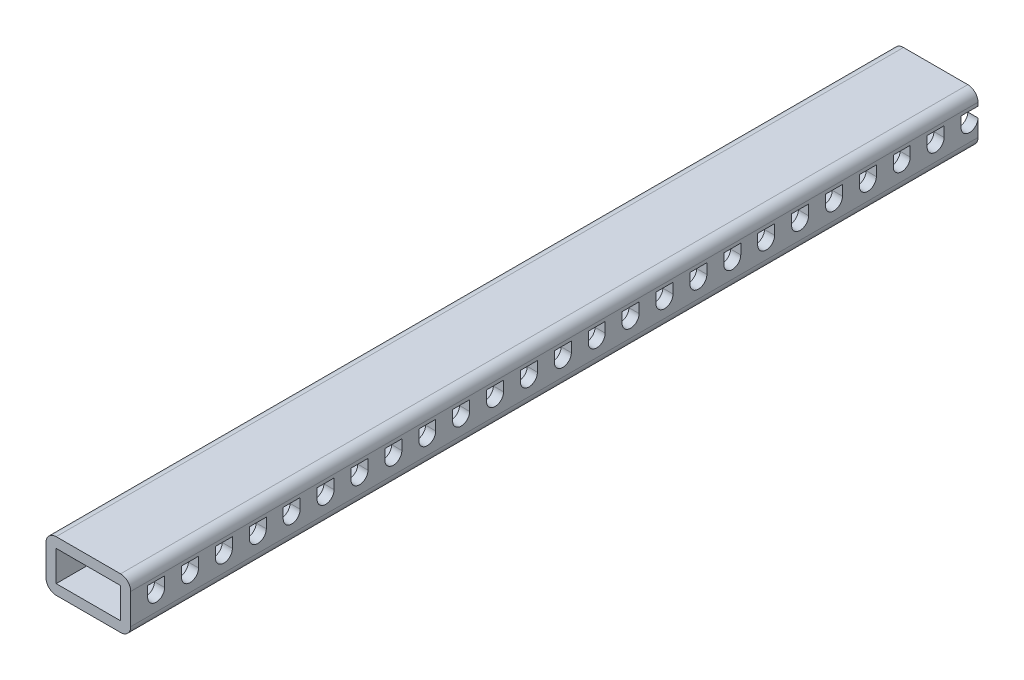
from build123d import *

# Parameters (mm, degrees)
SKETCH1_W           = 25
SKETCH1_H           = 15
BOSS_EXTRUDE1_DEPTH = 520
SKETCH2_W           = 19
SKETCH2_H           = 9
CUT_EXTRUDE1_DEPTH  = 263
CUT_EXTRUDE2_DEPTH  = 263
FILLET1_R           = 3
CUT_EXTRUDE6_DEPTH  = 29
SKETCH8_W           = 19
SKETCH8_H           = 9
CUT_EXTRUDE7_DEPTH  = 535
SKETCH9_W           = 298.646139341
SKETCH9_H           = 109.168966902
CUT_EXTRUDE8_DEPTH  = 64
SKETCH10_W          = 91.44174092
SKETCH10_H          = 50
CUT_EXTRUDE9_DEPTH  = 70


with BuildPart() as part:
    # Sketch1 → Boss-Extrude1 (new body)
    with BuildSketch(Plane.XY):
        Rectangle(SKETCH1_W, SKETCH1_H)
    extrude(amount=BOSS_EXTRUDE1_DEPTH)

    # Sketch2 → Cut-Extrude1 (cut)
    with BuildSketch(Plane.XY.offset(520)):
        Rectangle(SKETCH2_W, SKETCH2_H)
    extrude(amount=-CUT_EXTRUDE1_DEPTH, mode=Mode.SUBTRACT)

    # Sketch3 → Cut-Extrude2 (cut)
    with BuildSketch(Plane(origin=(12.5, 0, 0), x_dir=(0, 0, -1), z_dir=(1, 0, 0))):
        with BuildLine():
            Line((-515, 3.5), (-515, 0.5))
            ThreePointArc((-515, 0.5), (-512.5, -2), (-510, 0.5))
            Line((-510, 0.5), (-510, 3.5))
            Line((-510, 3.5), (-515, 3.5))
        make_face()
        with BuildLine():
            ThreePointArc((-500, 0.5), (-502.5, -2), (-505, 0.5))
            Line((-505, 0.5), (-505, 3.5))
            Line((-505, 3.5), (-500, 3.5))
            Line((-500, 3.5), (-500, 0.5))
        make_face()
        with BuildLine():
            Line((-495, 3.5), (-495, 0.5))
            ThreePointArc((-495, 0.5), (-492.5, -2), (-490, 0.5))
            Line((-490, 0.5), (-490, 3.5))
            Line((-490, 3.5), (-495, 3.5))
        make_face()
        with BuildLine():
            ThreePointArc((-480, 0.5), (-482.5, -2), (-485, 0.5))
            Line((-485, 0.5), (-485, 3.5))
            Line((-485, 3.5), (-480, 3.5))
            Line((-480, 3.5), (-480, 0.5))
        make_face()
        with BuildLine():
            Line((-475, 3.5), (-475, 0.5))
            ThreePointArc((-475, 0.5), (-472.5, -2), (-470, 0.5))
            Line((-470, 0.5), (-470, 3.5))
            Line((-470, 3.5), (-475, 3.5))
        make_face()
        with BuildLine():
            ThreePointArc((-460, 0.5), (-462.5, -2), (-465, 0.5))
            Line((-465, 0.5), (-465, 3.5))
            Line((-465, 3.5), (-460, 3.5))
            Line((-460, 3.5), (-460, 0.5))
        make_face()
        with BuildLine():
            Line((-455, 3.5), (-455, 0.5))
            ThreePointArc((-455, 0.5), (-452.5, -2), (-450, 0.5))
            Line((-450, 0.5), (-450, 3.5))
            Line((-450, 3.5), (-455, 3.5))
        make_face()
        with BuildLine():
            ThreePointArc((-440, 0.5), (-442.5, -2), (-445, 0.5))
            Line((-445, 0.5), (-445, 3.5))
            Line((-445, 3.5), (-440, 3.5))
            Line((-440, 3.5), (-440, 0.5))
        make_face()
        with BuildLine():
            Line((-435, 3.5), (-435, 0.5))
            ThreePointArc((-435, 0.5), (-432.5, -2), (-430, 0.5))
            Line((-430, 0.5), (-430, 3.5))
            Line((-430, 3.5), (-435, 3.5))
        make_face()
        with BuildLine():
            ThreePointArc((-420, 0.5), (-422.5, -2), (-425, 0.5))
            Line((-425, 0.5), (-425, 3.5))
            Line((-425, 3.5), (-420, 3.5))
            Line((-420, 3.5), (-420, 0.5))
        make_face()
        with BuildLine():
            Line((-415, 3.5), (-415, 0.5))
            ThreePointArc((-415, 0.5), (-412.5, -2), (-410, 0.5))
            Line((-410, 0.5), (-410, 3.5))
            Line((-410, 3.5), (-415, 3.5))
        make_face()
        with BuildLine():
            ThreePointArc((-400, 0.5), (-402.5, -2), (-405, 0.5))
            Line((-405, 0.5), (-405, 3.5))
            Line((-405, 3.5), (-400, 3.5))
            Line((-400, 3.5), (-400, 0.5))
        make_face()
        with BuildLine():
            Line((-395, 3.5), (-395, 0.5))
            ThreePointArc((-395, 0.5), (-392.5, -2), (-390, 0.5))
            Line((-390, 0.5), (-390, 3.5))
            Line((-390, 3.5), (-395, 3.5))
        make_face()
        with BuildLine():
            ThreePointArc((-380, 0.5), (-382.5, -2), (-385, 0.5))
            Line((-385, 0.5), (-385, 3.5))
            Line((-385, 3.5), (-380, 3.5))
            Line((-380, 3.5), (-380, 0.5))
        make_face()
        with BuildLine():
            Line((-375, 3.5), (-375, 0.5))
            ThreePointArc((-375, 0.5), (-372.5, -2), (-370, 0.5))
            Line((-370, 0.5), (-370, 3.5))
            Line((-370, 3.5), (-375, 3.5))
        make_face()
        with BuildLine():
            ThreePointArc((-360, 0.5), (-362.5, -2), (-365, 0.5))
            Line((-365, 0.5), (-365, 3.5))
            Line((-365, 3.5), (-360, 3.5))
            Line((-360, 3.5), (-360, 0.5))
        make_face()
        with BuildLine():
            Line((-355, 3.5), (-355, 0.5))
            ThreePointArc((-355, 0.5), (-352.5, -2), (-350, 0.5))
            Line((-350, 0.5), (-350, 3.5))
            Line((-350, 3.5), (-355, 3.5))
        make_face()
        with BuildLine():
            ThreePointArc((-340, 0.5), (-342.5, -2), (-345, 0.5))
            Line((-345, 0.5), (-345, 3.5))
            Line((-345, 3.5), (-340, 3.5))
            Line((-340, 3.5), (-340, 0.5))
        make_face()
        with BuildLine():
            Line((-335, 3.5), (-335, 0.5))
            ThreePointArc((-335, 0.5), (-332.5, -2), (-330, 0.5))
            Line((-330, 0.5), (-330, 3.5))
            Line((-330, 3.5), (-335, 3.5))
        make_face()
        with BuildLine():
            ThreePointArc((-320, 0.5), (-322.5, -2), (-325, 0.5))
            Line((-325, 0.5), (-325, 3.5))
            Line((-325, 3.5), (-320, 3.5))
            Line((-320, 3.5), (-320, 0.5))
        make_face()
        with BuildLine():
            Line((-315, 3.5), (-315, 0.5))
            ThreePointArc((-315, 0.5), (-312.5, -2), (-310, 0.5))
            Line((-310, 0.5), (-310, 3.5))
            Line((-310, 3.5), (-315, 3.5))
        make_face()
        with BuildLine():
            ThreePointArc((-300, 0.5), (-302.5, -2), (-305, 0.5))
            Line((-305, 0.5), (-305, 3.5))
            Line((-305, 3.5), (-300, 3.5))
            Line((-300, 3.5), (-300, 0.5))
        make_face()
    extrude(amount=-CUT_EXTRUDE2_DEPTH, mode=Mode.SUBTRACT)

    # Fillet1
    fillet1_edges = [part.edges().sort_by_distance(p)[0] for p in [
        (12.5, -7.5, 260),
        (-12.5, -7.5, 260),
        (-12.5, 7.5, 260),
        (12.5, 7.5, 260),
    ]]
    fillet(fillet1_edges, radius=FILLET1_R)

    # Sketch7 → Cut-Extrude6 (cut)
    with BuildSketch(Plane(origin=(12.5, 0, 0), x_dir=(0, 0, -1), z_dir=(1, 0, 0))):
        with BuildLine():
            ThreePointArc((-290, 0.5), (-292.5, -2), (-295, 0.5))
            Line((-295, 0.5), (-295, 3.5))
            Line((-295, 3.5), (-290, 3.5))
            Line((-290, 3.5), (-290, 0.5))
        make_face()
        with BuildLine():
            Line((-285, 0.5), (-285, 3.5))
            Line((-285, 3.5), (-280, 3.5))
            Line((-280, 3.5), (-280, 0.5))
            ThreePointArc((-280, 0.5), (-282.5, -2), (-285, 0.5))
        make_face()
        with BuildLine():
            ThreePointArc((-270, 0.5), (-272.5, -2), (-275, 0.5))
            Line((-275, 0.5), (-275, 3.5))
            Line((-275, 3.5), (-270, 3.5))
            Line((-270, 3.5), (-270, 0.5))
        make_face()
        with BuildLine():
            Line((-265, 0.5), (-265, 3.5))
            Line((-265, 3.5), (-260, 3.5))
            Line((-260, 3.5), (-260, 0.5))
            ThreePointArc((-260, 0.5), (-262.5, -2), (-265, 0.5))
        make_face()
        with BuildLine():
            ThreePointArc((-250, 0.5), (-252.5, -2), (-255, 0.5))
            Line((-255, 0.5), (-255, 3.5))
            Line((-255, 3.5), (-250, 3.5))
            Line((-250, 3.5), (-250, 0.5))
        make_face()
        with BuildLine():
            Line((-245, 0.5), (-245, 3.5))
            Line((-245, 3.5), (-240, 3.5))
            Line((-240, 3.5), (-240, 0.5))
            ThreePointArc((-240, 0.5), (-242.5, -2), (-245, 0.5))
        make_face()
        with BuildLine():
            ThreePointArc((-230, 0.5), (-232.5, -2), (-235, 0.5))
            Line((-235, 0.5), (-235, 3.5))
            Line((-235, 3.5), (-230, 3.5))
            Line((-230, 3.5), (-230, 0.5))
        make_face()
        with BuildLine():
            Line((-225, 0.5), (-225, 3.5))
            Line((-225, 3.5), (-220, 3.5))
            Line((-220, 3.5), (-220, 0.5))
            ThreePointArc((-220, 0.5), (-222.5, -2), (-225, 0.5))
        make_face()
        with BuildLine():
            ThreePointArc((-210, 0.5), (-212.5, -2), (-215, 0.5))
            Line((-215, 0.5), (-215, 3.5))
            Line((-215, 3.5), (-210, 3.5))
            Line((-210, 3.5), (-210, 0.5))
        make_face()
        with BuildLine():
            Line((-205, 0.5), (-205, 3.5))
            Line((-205, 3.5), (-200, 3.5))
            Line((-200, 3.5), (-200, 0.5))
            ThreePointArc((-200, 0.5), (-202.5, -2), (-205, 0.5))
        make_face()
        with BuildLine():
            ThreePointArc((-190, 0.5), (-192.5, -2), (-195, 0.5))
            Line((-195, 0.5), (-195, 3.5))
            Line((-195, 3.5), (-190, 3.5))
            Line((-190, 3.5), (-190, 0.5))
        make_face()
        with BuildLine():
            Line((-185, 0.5), (-185, 3.5))
            Line((-185, 3.5), (-180, 3.5))
            Line((-180, 3.5), (-180, 0.5))
            ThreePointArc((-180, 0.5), (-182.5, -2), (-185, 0.5))
        make_face()
        with BuildLine():
            ThreePointArc((-170, 0.5), (-172.5, -2), (-175, 0.5))
            Line((-175, 0.5), (-175, 3.5))
            Line((-175, 3.5), (-170, 3.5))
            Line((-170, 3.5), (-170, 0.5))
        make_face()
        with BuildLine():
            Line((-165, 0.5), (-165, 3.5))
            Line((-165, 3.5), (-160, 3.5))
            Line((-160, 3.5), (-160, 0.5))
            ThreePointArc((-160, 0.5), (-162.5, -2), (-165, 0.5))
        make_face()
        with BuildLine():
            ThreePointArc((-150, 0.5), (-152.5, -2), (-155, 0.5))
            Line((-155, 0.5), (-155, 3.5))
            Line((-155, 3.5), (-150, 3.5))
            Line((-150, 3.5), (-150, 0.5))
        make_face()
        with BuildLine():
            Line((-145, 0.5), (-145, 3.5))
            Line((-145, 3.5), (-140, 3.5))
            Line((-140, 3.5), (-140, 0.5))
            ThreePointArc((-140, 0.5), (-142.5, -2), (-145, 0.5))
        make_face()
        with BuildLine():
            ThreePointArc((-130, 0.5), (-132.5, -2), (-135, 0.5))
            Line((-135, 0.5), (-135, 3.5))
            Line((-135, 3.5), (-130, 3.5))
            Line((-130, 3.5), (-130, 0.5))
        make_face()
        with BuildLine():
            Line((-125, 0.5), (-125, 3.5))
            Line((-125, 3.5), (-120, 3.5))
            Line((-120, 3.5), (-120, 0.5))
            ThreePointArc((-120, 0.5), (-122.5, -2), (-125, 0.5))
        make_face()
        with BuildLine():
            ThreePointArc((-110, 0.5), (-112.5, -2), (-115, 0.5))
            Line((-115, 0.5), (-115, 3.5))
            Line((-115, 3.5), (-110, 3.5))
            Line((-110, 3.5), (-110, 0.5))
        make_face()
        with BuildLine():
            Line((-105, 0.5), (-105, 3.5))
            Line((-105, 3.5), (-100, 3.5))
            Line((-100, 3.5), (-100, 0.5))
            ThreePointArc((-100, 0.5), (-102.5, -2), (-105, 0.5))
        make_face()
        with BuildLine():
            ThreePointArc((-90, 0.5), (-92.5, -2), (-95, 0.5))
            Line((-95, 0.5), (-95, 3.5))
            Line((-95, 3.5), (-90, 3.5))
            Line((-90, 3.5), (-90, 0.5))
        make_face()
        with BuildLine():
            Line((-85, 0.5), (-85, 3.5))
            Line((-85, 3.5), (-80, 3.5))
            Line((-80, 3.5), (-80, 0.5))
            ThreePointArc((-80, 0.5), (-82.5, -2), (-85, 0.5))
        make_face()
        with BuildLine():
            ThreePointArc((-70, 0.5), (-72.5, -2), (-75, 0.5))
            Line((-75, 0.5), (-75, 3.5))
            Line((-75, 3.5), (-70, 3.5))
            Line((-70, 3.5), (-70, 0.5))
        make_face()
        with BuildLine():
            Line((-65, 0.5), (-65, 3.5))
            Line((-65, 3.5), (-60, 3.5))
            Line((-60, 3.5), (-60, 0.5))
            ThreePointArc((-60, 0.5), (-62.5, -2), (-65, 0.5))
        make_face()
        with BuildLine():
            ThreePointArc((-50, 0.5), (-52.5, -2), (-55, 0.5))
            Line((-55, 0.5), (-55, 3.5))
            Line((-55, 3.5), (-50, 3.5))
            Line((-50, 3.5), (-50, 0.5))
        make_face()
        with BuildLine():
            Line((-45, 0.5), (-45, 3.5))
            Line((-45, 3.5), (-40, 3.5))
            Line((-40, 3.5), (-40, 0.5))
            ThreePointArc((-40, 0.5), (-42.5, -2), (-45, 0.5))
        make_face()
        with BuildLine():
            ThreePointArc((-30, 0.5), (-32.5, -2), (-35, 0.5))
            Line((-35, 0.5), (-35, 3.5))
            Line((-35, 3.5), (-30, 3.5))
            Line((-30, 3.5), (-30, 0.5))
        make_face()
        with BuildLine():
            Line((-25, 0.5), (-25, 3.5))
            Line((-25, 3.5), (-20, 3.5))
            Line((-20, 3.5), (-20, 0.5))
            ThreePointArc((-20, 0.5), (-22.5, -2), (-25, 0.5))
        make_face()
        with BuildLine():
            ThreePointArc((-10, 0.5), (-12.5, -2), (-15, 0.5))
            Line((-15, 0.5), (-15, 3.5))
            Line((-15, 3.5), (-10, 3.5))
            Line((-10, 3.5), (-10, 0.5))
        make_face()
    extrude(amount=-CUT_EXTRUDE6_DEPTH, mode=Mode.SUBTRACT)

    # Sketch8 → Cut-Extrude7 (cut)
    with BuildSketch(Plane(origin=(0, 0, 0), x_dir=(-1, 0, 0), z_dir=(0, 0, -1))):
        Rectangle(SKETCH8_W, SKETCH8_H)
    extrude(amount=-CUT_EXTRUDE7_DEPTH, mode=Mode.SUBTRACT)

    # Sketch9 → Cut-Extrude8 (cut)
    with BuildSketch(Plane.ZY.offset(12.5)):
        with Locations((449.323069671, 33.898308976)):
            Rectangle(SKETCH9_W, SKETCH9_H)
    extrude(amount=-CUT_EXTRUDE8_DEPTH, mode=Mode.SUBTRACT)

    # Sketch10 → Cut-Extrude9 (cut)
    with BuildSketch(Plane(origin=(0, 7.5, 0), x_dir=(1, 0, 0), z_dir=(0, 1, 0))):
        with Locations((33.22087046, -25)):
            Rectangle(SKETCH10_W, SKETCH10_H)
    extrude(amount=-CUT_EXTRUDE9_DEPTH, mode=Mode.SUBTRACT)


solid = part.part
